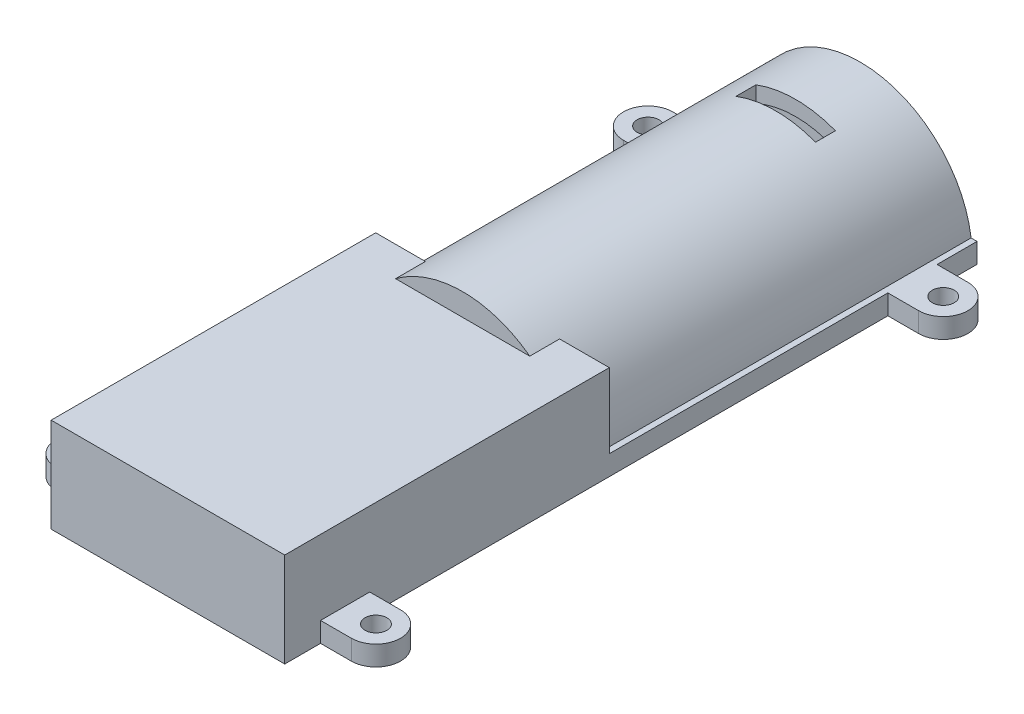
from build123d import *

# Parameters (mm, degrees)
SKETCH1_R               = 4.95
SKETCH1_R_2             = 2.2
BOSS_EXTRUDE1_DEPTH     = 4
SKETCH2_W               = 47
SKETCH2_H               = 139.3
BOSS_EXTRUDE2_DEPTH     = 19.5
SKETCH3_W               = 41
SKETCH3_H               = 59.3
CUT_EXTRUDE1_DEPTH      = 16
CUT_EXTRUDE3_START      = -3
SKETCH6_R               = 19.5
CUT_EXTRUDE3_DEPTH      = 76
CUT_EXTRUDE4_DEPTH      = 74
CUT_EXTRUDE6_REACH      = 110.634
CUT_EXTRUDE7_DEPTH      = 130.68327973
CUT_EXTRUDE7_DEPTH_BACK = 130.68327973
SKETCH10_W              = 16
SKETCH10_H              = 4
SKETCH12_W              = 47
SKETCH12_H              = 59.3
CUT_EXTRUDE8_DEPTH      = 130.609039197


with BuildPart() as part:
    # Sketch1 → Boss-Extrude1 (new body)
    # profile 1 of 9: a face of its own
    with BuildSketch(Plane(origin=(0, 0, 0), x_dir=(1, 0, 0), z_dir=(0, 1, 0))):
        with Locations((11.630264395, 23.030922034)):
            Circle(SKETCH1_R)
        with Locations(Location((11.630264395, 23.030922034, 0), (0, 0, 270))):
            Circle(SKETCH1_R_2, mode=Mode.SUBTRACT)
    # profile 2 of 9: a face of its own
    with BuildSketch(Plane(origin=(0, 0, 0), x_dir=(1, 0, 0), z_dir=(0, 1, 0))):
        with BuildLine():
            Line((17.830264395, 18.080922034), (17.830264395, 27.980922034))
            Line((17.830264395, 27.980922034), (11.630264395, 27.980922034))
            ThreePointArc((11.630264395, 27.980922034), (15.130442962, 26.5311006), (16.580264395, 23.030922034))
            ThreePointArc((16.580264395, 23.030922034), (15.130442962, 19.530743467), (11.630264395, 18.080922034))
            Line((11.630264395, 18.080922034), (17.830264395, 18.080922034))
        make_face()
    # profile 3 of 9: a face of its own
    with BuildSketch(Plane(origin=(0, 0, 0), x_dir=(1, 0, 0), z_dir=(0, 1, 0))):
        Polygon((64.830264395, -86.169077966), (64.830264395, 18.080922034), (64.830264395, 27.980922034), (64.830264395, 36.030922034), (17.830264395, 36.030922034), (17.830264395, 27.980922034), (17.830264395, 18.080922034), (17.830264395, -86.169077966), (17.830264395, -96.069077966), (17.830264395, -103.269077966), (64.830264395, -103.269077966), (64.830264395, -96.069077966), align=None)
    # profile 4 of 9: a face of its own
    with BuildSketch(Plane(origin=(0, 0, 0), x_dir=(1, 0, 0), z_dir=(0, 1, 0))):
        with Locations((71.030264395, 23.030922034)):
            Circle(SKETCH1_R)
        with Locations(Location((71.030264395, 23.030922034, 0), (0, 0, 270))):
            Circle(SKETCH1_R_2, mode=Mode.SUBTRACT)
    # profile 5 of 9: a face of its own
    with BuildSketch(Plane(origin=(0, 0, 0), x_dir=(1, 0, 0), z_dir=(0, 1, 0))):
        with BuildLine():
            Line((64.830264395, 18.080922034), (71.030264395, 18.080922034))
            ThreePointArc((71.030264395, 18.080922034), (66.080264395, 23.030922034), (71.030264395, 27.980922034))
            Line((71.030264395, 27.980922034), (64.830264395, 27.980922034))
            Line((64.830264395, 27.980922034), (64.830264395, 18.080922034))
        make_face()
    # profile 6 of 9: a face of its own
    with BuildSketch(Plane(origin=(0, 0, 0), x_dir=(1, 0, 0), z_dir=(0, 1, 0))):
        with BuildLine():
            Line((71.030264395, -86.169077966), (64.830264395, -86.169077966))
            Line((64.830264395, -86.169077966), (64.830264395, -96.069077966))
            Line((64.830264395, -96.069077966), (71.030264395, -96.069077966))
            ThreePointArc((71.030264395, -96.069077966), (66.080264395, -91.119077966), (71.030264395, -86.169077966))
        make_face()
    # profile 7 of 9: a face of its own
    with BuildSketch(Plane(origin=(0, 0, 0), x_dir=(1, 0, 0), z_dir=(0, 1, 0))):
        with Locations((71.030264395, -91.119077966)):
            Circle(SKETCH1_R)
        with Locations(Location((71.030264395, -91.119077966, 0), (0, 0, 270))):
            Circle(SKETCH1_R_2, mode=Mode.SUBTRACT)
    # profile 8 of 9: a face of its own
    with BuildSketch(Plane(origin=(0, 0, 0), x_dir=(1, 0, 0), z_dir=(0, 1, 0))):
        with BuildLine():
            Line((11.630264395, -96.069077966), (17.830264395, -96.069077966))
            Line((17.830264395, -96.069077966), (17.830264395, -86.169077966))
            Line((17.830264395, -86.169077966), (11.630264395, -86.169077966))
            ThreePointArc((11.630264395, -86.169077966), (15.130442962, -87.6188994), (16.580264395, -91.119077966))
            ThreePointArc((16.580264395, -91.119077966), (15.130442962, -94.619256533), (11.630264395, -96.069077966))
        make_face()
    # profile 9 of 9: a face of its own
    with BuildSketch(Plane(origin=(0, 0, 0), x_dir=(1, 0, 0), z_dir=(0, 1, 0))):
        with Locations((11.630264395, -91.119077966)):
            Circle(SKETCH1_R)
        with Locations(Location((11.630264395, -91.119077966, 0), (0, 0, 270))):
            Circle(SKETCH1_R_2, mode=Mode.SUBTRACT)
    extrude(amount=BOSS_EXTRUDE1_DEPTH)

    # Sketch2 → Boss-Extrude2 (add)
    with BuildSketch(Plane(origin=(0, 4, 0), x_dir=(1, 0, 0), z_dir=(0, 1, 0))):
        with Locations((41.330264395, -33.619077966)):
            Rectangle(SKETCH2_W, SKETCH2_H)
    extrude(amount=BOSS_EXTRUDE2_DEPTH)

    # Sketch3 → Cut-Extrude1 (cut)
    with BuildSketch(Plane.XZ):
        with Locations((41.330264395, 70.619077966)):
            Rectangle(SKETCH3_W, SKETCH3_H)
    extrude(amount=-CUT_EXTRUDE1_DEPTH, mode=Mode.SUBTRACT)

    # Sketch6 → Cut-Extrude3 (cut)
    with BuildSketch(Plane(origin=(0, 0, -36.030922034), x_dir=(-1, 0, 0), z_dir=(0, 0, -1)).offset(CUT_EXTRUDE3_START)):
        with Locations((-41.330264395, 1)):
            Circle(SKETCH6_R)
    extrude(amount=-CUT_EXTRUDE3_DEPTH, mode=Mode.SUBTRACT)

    # Sketch7 → Cut-Extrude4 (cut)
    with BuildSketch(Plane(origin=(0, 0, -36.030922034), x_dir=(-1, 0, 0), z_dir=(0, 0, -1))):
        with BuildLine():
            Line((-64.830264395, 23.5), (-64.830264395, 4))
            Line((-64.830264395, 4), (-63.629367516, 4))
            ThreePointArc((-63.629367516, 4), (-56.141577638, 17.937384686), (-41.330264395, 23.5))
            Line((-41.330264395, 23.5), (-64.830264395, 23.5))
        make_face()
        with BuildLine():
            Line((-17.830264395, 23.5), (-41.330264395, 23.5))
            ThreePointArc((-41.330264395, 23.5), (-26.518951151, 17.937384686), (-19.031161274, 4))
            Line((-19.031161274, 4), (-17.830264395, 4))
            Line((-17.830264395, 4), (-17.830264395, 23.5))
        make_face()
    extrude(amount=-CUT_EXTRUDE4_DEPTH, mode=Mode.SUBTRACT)

    # Sketch9 → Cut-Extrude6 (cut, up to next)
    with BuildSketch(Plane(origin=(0, 0, 37.969077966), x_dir=(-1, 0, 0), z_dir=(0, 0, -1)), mode=Mode.PRIVATE) as cut_extrude6_sk1:
        with BuildLine():
            Line((-64.830264395, 19), (-54.830264395, 19))
            ThreePointArc((-54.830264395, 19), (-48.44538913, 22.345374206), (-41.330264395, 23.5))
            Line((-41.330264395, 23.5), (-64.830264395, 23.5))
            Line((-64.830264395, 23.5), (-64.830264395, 19))
        make_face()
    cut_extrude6_tool1 = extrude(cut_extrude6_sk1.sketch, amount=-CUT_EXTRUDE6_REACH, mode=Mode.PRIVATE) & part.part
    # Sketch9 → Cut-Extrude6 (cut, up to next)
    with BuildSketch(Plane(origin=(0, 0, 37.969077966), x_dir=(-1, 0, 0), z_dir=(0, 0, -1)), mode=Mode.PRIVATE) as cut_extrude6_sk2:
        with BuildLine():
            Line((-27.830264395, 19), (-17.830264395, 19))
            Line((-17.830264395, 19), (-17.830264395, 23.5))
            Line((-17.830264395, 23.5), (-41.330264395, 23.5))
            ThreePointArc((-41.330264395, 23.5), (-34.215139659, 22.345374206), (-27.830264395, 19))
        make_face()
    cut_extrude6_tool2 = extrude(cut_extrude6_sk2.sketch, amount=-CUT_EXTRUDE6_REACH, mode=Mode.PRIVATE) & part.part
    add(cut_extrude6_tool1.solids().sort_by_distance((57.332082, 21.52882, 37.969078))[0], mode=Mode.SUBTRACT)
    add(cut_extrude6_tool2.solids().sort_by_distance((25.328447, 21.52882, 37.969078))[0], mode=Mode.SUBTRACT)

    # Sketch10 → Cut-Extrude7 (cut, two sides: drawn at the far end of the back side and taken through both)
    with BuildSketch(Plane(origin=(0, 4, 0), x_dir=(1, 0, 0), z_dir=(0, 1, 0)).offset(-CUT_EXTRUDE7_DEPTH_BACK)):
        with Locations((41.330264395, 21.030922034)):
            Rectangle(SKETCH10_W, SKETCH10_H)
    extrude(amount=CUT_EXTRUDE7_DEPTH + CUT_EXTRUDE7_DEPTH_BACK, mode=Mode.SUBTRACT)

    # Sketch12 → Cut-Extrude8 (cut, through all)
    with BuildSketch(Plane(origin=(0, 19, 0), x_dir=(1, 0, 0), z_dir=(0, 1, 0))):
        with Locations((41.330264395, -73.619077966)):
            Rectangle(SKETCH12_W, SKETCH12_H)
    extrude(amount=CUT_EXTRUDE8_DEPTH, mode=Mode.SUBTRACT)


solid = part.part
